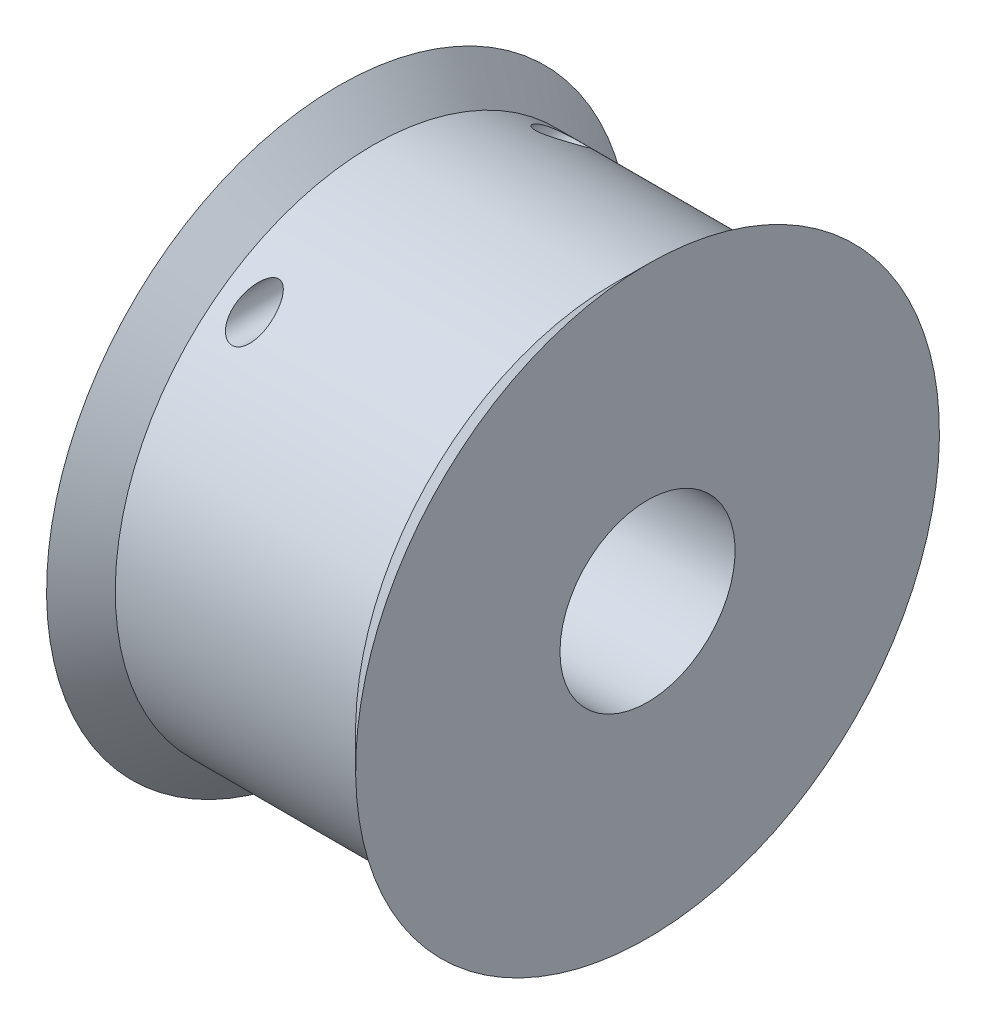
from build123d import *

# Parameters (mm, degrees)
ENL_V_MAT_EXTRU_1_DEPTH      = 31.033314835
ENL_V_MAT_EXTRU_1_DEPTH_BACK = 31.033314835
ESQUISSE2_R                  = 5.1
ENL_V_MAT_EXTRU_2_DEPTH      = 26.670995306
ENL_V_MAT_EXTRU_2_DEPTH_BACK = 26.670995306
ESQUISSE3_R                  = 1
ESQUISSE4_R                  = 1.65
ENL_V_MAT_EXTRU_3_DEPTH      = 26.670995306


with BuildPart() as part:
    # Esquisse1 → Révolution1 (revolve)
    with BuildSketch(Plane.XY):
        Polygon((9, 0), (9, 17), (7, 15), (-7, 15), (-9, 17), (-9, 0), align=None)
    revolve(axis=Axis((9, 0, 0), (-1, 0, 0)))

    # Esquisse2 → Enlèv. mat.-Extru.1 (cut, two sides: drawn at the far end of the back side and taken through both)
    with BuildSketch(Plane.ZY.offset(9).offset(-ENL_V_MAT_EXTRU_1_DEPTH_BACK)):
        Circle(ESQUISSE2_R)
    extrude(amount=ENL_V_MAT_EXTRU_1_DEPTH + ENL_V_MAT_EXTRU_1_DEPTH_BACK, mode=Mode.SUBTRACT)

    # Esquisse3 → Enlèv. mat.-Extru.2 (cut, two sides: drawn at the far end of the back side and taken through both)
    with BuildSketch(Plane.XY.offset(-ENL_V_MAT_EXTRU_2_DEPTH_BACK)):
        with Locations((-5, 12)):
            Circle(ESQUISSE3_R)
    extrude(amount=ENL_V_MAT_EXTRU_2_DEPTH + ENL_V_MAT_EXTRU_2_DEPTH_BACK, mode=Mode.SUBTRACT)

    # Esquisse4 → Enlèv. mat.-Extru.3 (cut, through all)
    with BuildSketch(Plane.XY):
        Circle(ESQUISSE4_R)
    extrude(amount=-ENL_V_MAT_EXTRU_3_DEPTH, mode=Mode.SUBTRACT)


solid = part.part
